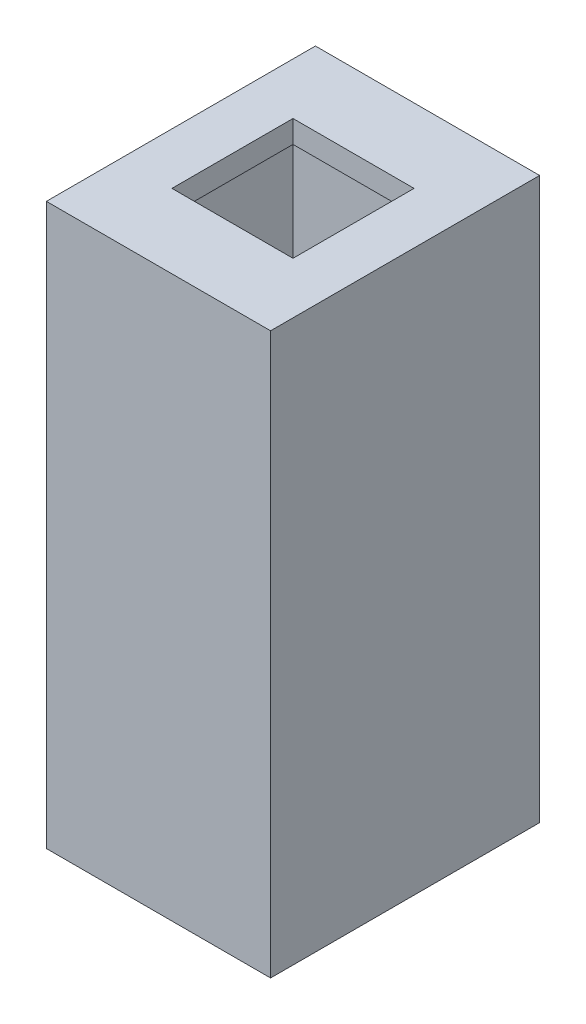
from build123d import *

# Parameters (mm, degrees)
SKETCH_1_W          = 10
SKETCH_1_H          = 12
SKETCH_1_W_2        = 6.2
SKETCH_1_H_2        = 6.2
EXTRUDE_1_DEPTH     = 25
EXTRUDE_START       = 25
SKETCH_1_3_W        = 10
SKETCH_1_3_H        = 12
SKETCH_1_3_W_2      = 6.2
SKETCH_1_3_H_2      = 6.2
SKETCH_1_3_W_3      = 5.4
SKETCH_1_3_H_3      = 5.4
EXTRUDE_2_DEPTH     = 1
SKETCH_2_R          = 0.3
CUT_EXTRUDE_1_DEPTH = 2


with BuildPart() as part:
    # 草图1 → 凸台-拉伸1 (new body)
    with BuildSketch(Plane(origin=(0, 0, 0), x_dir=(1, 0, 0), z_dir=(0, 1, 0))):
        Rectangle(SKETCH_1_W, SKETCH_1_H)
        Rectangle(SKETCH_1_W_2, SKETCH_1_H_2, mode=Mode.SUBTRACT)
    extrude(amount=EXTRUDE_1_DEPTH)

    # 草图1<3> → 凸台-拉伸2 (add)
    # profile 1 of 2: a face of its own
    with BuildSketch(Plane(origin=(0, 0, 0), x_dir=(1, 0, 0), z_dir=(0, 1, 0)).offset(EXTRUDE_START)):
        Rectangle(SKETCH_1_3_W, SKETCH_1_3_H)
        Rectangle(SKETCH_1_3_W_2, SKETCH_1_3_H_2, mode=Mode.SUBTRACT)
    # profile 2 of 2: a face of its own
    with BuildSketch(Plane(origin=(0, 0, 0), x_dir=(1, 0, 0), z_dir=(0, 1, 0)).offset(EXTRUDE_START)):
        Rectangle(SKETCH_1_3_W_2, SKETCH_1_3_H_2)
        Rectangle(SKETCH_1_3_W_3, SKETCH_1_3_H_3, mode=Mode.SUBTRACT)
    extrude(amount=-EXTRUDE_2_DEPTH)

    # 草图2 → 切除-拉伸1 (cut)
    with BuildSketch(Plane.XZ):
        with Locations(Location((-3.75, 4.5, 0), (0, 0, 270))):
            Circle(SKETCH_2_R)
        with Locations(Location((3.75, -4.5, 0), (0, 0, 270))):
            Circle(SKETCH_2_R)
        with Locations(Location((3.75, 4.5, 0), (0, 0, 270))):
            Circle(SKETCH_2_R)
        with Locations(Location((-3.75, -4.5, 0), (0, 0, 270))):
            Circle(SKETCH_2_R)
    extrude(amount=-CUT_EXTRUDE_1_DEPTH, mode=Mode.SUBTRACT)


solid = part.part
